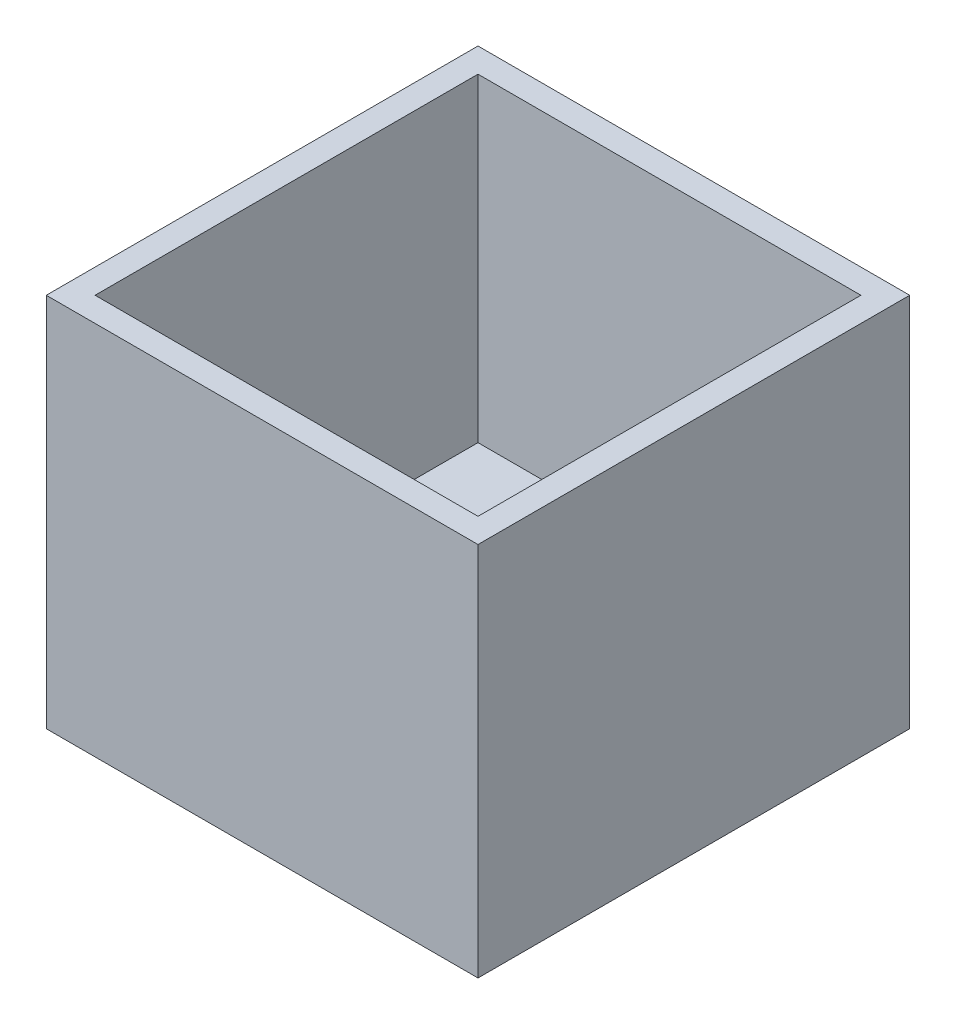
from build123d import *

# Parameters (mm, degrees)
SKETCH2_W           = 23
SKETCH2_H           = 23
BOSS_EXTRUDE1_DEPTH = 20
SKETCH3_W           = 20.4
SKETCH3_H           = 20.4
CUT_EXTRUDE1_DEPTH  = 17


with BuildPart() as part:
    # Sketch2 → Boss-Extrude1 (new body)
    with BuildSketch(Plane(origin=(0, 0, 0), x_dir=(1, 0, 0), z_dir=(0, 1, 0))):
        Rectangle(SKETCH2_W, SKETCH2_H)
    extrude(amount=BOSS_EXTRUDE1_DEPTH)

    # Sketch3 → Cut-Extrude1 (cut)
    with BuildSketch(Plane(origin=(0, 20, 0), x_dir=(1, 0, 0), z_dir=(0, 1, 0))):
        Rectangle(SKETCH3_W, SKETCH3_H)
    extrude(amount=-CUT_EXTRUDE1_DEPTH, mode=Mode.SUBTRACT)


solid = part.part
